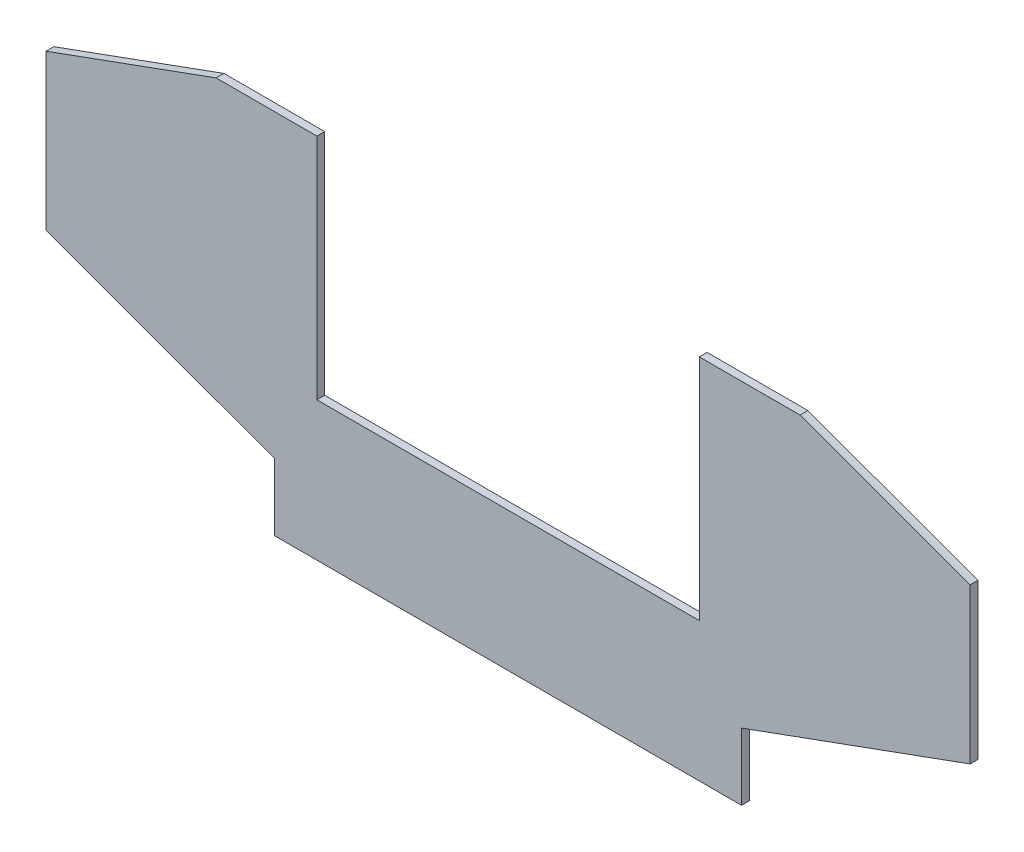
from build123d import *

# Parameters (mm, degrees)
BOSS_EXTRU_1_DEPTH = 2


with BuildPart() as part:
    # Esquisse1 → Boss.-Extru.1 (new body)
    with BuildSketch(Plane.XY):
        Polygon((59.824590337, -58.361611466), (-59.824590337, -58.361611466), (-59.824590337, -41.216720668), (-118.422151654, -19.888952548), (-118.422151654, 19.888952548), (-74.824590337, 35.757167154), (-49, 35.757167154), (-49, -22.768388534), (49, -22.768388534), (49, 35.757167154), (74.824590337, 35.757167154), (118.422151654, 19.888952548), (118.422151654, -19.888952548), (59.824590337, -41.216720668), align=None)
    extrude(amount=BOSS_EXTRU_1_DEPTH)


solid = part.part
